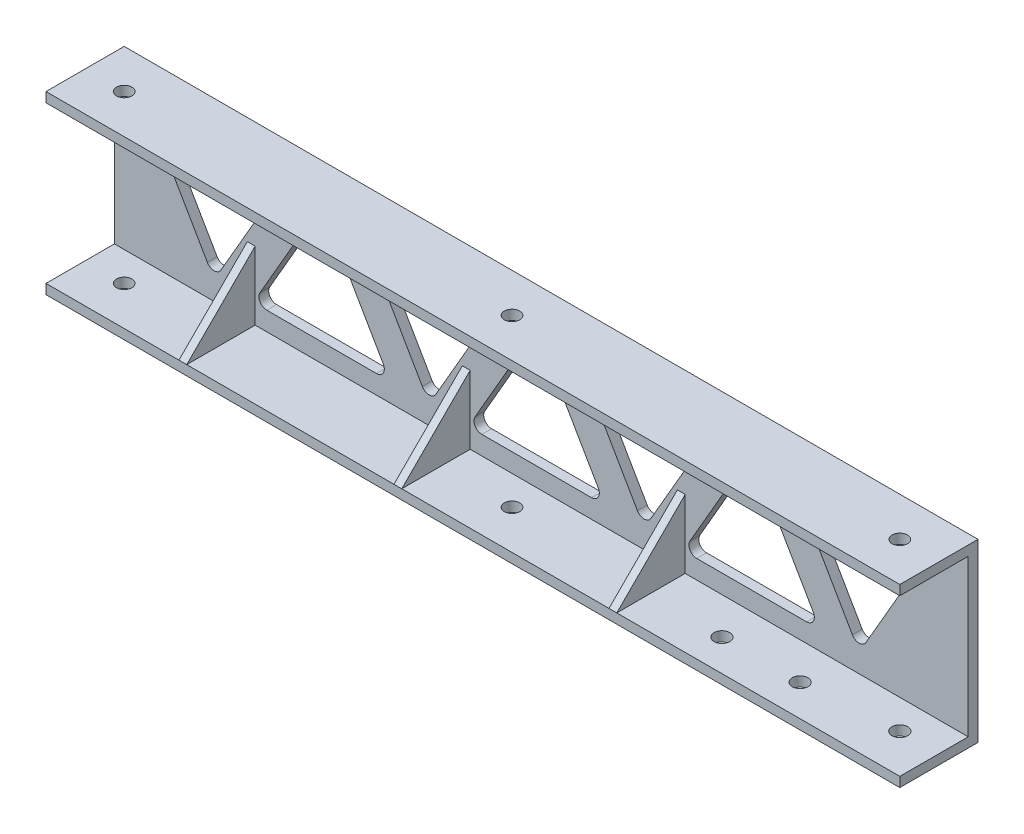
from build123d import *

# Parameters (mm, degrees)
SKETCH1_W                  = 277.368
SKETCH1_H                  = 57.15
BOSS_EXTRUDE1_DEPTH        = 3.175
SKETCH2_W                  = 277.368
SKETCH2_H                  = 25.4
BOSS_EXTRUDE2_DEPTH        = 3.175
SKETCH3_W                  = 277.368
SKETCH3_H                  = 25.4
BOSS_EXTRUDE3_DEPTH        = 3.175
BOSS_EXTRUDE4_DEPTH        = 2.54
BOSS_EXTRUDE5_DEPTH        = 2.54
BOSS_EXTRUDE6_DEPTH        = 2.54
BOSS_EXTRUDE7_DEPTH        = 2.54
BOSS_EXTRUDE8_DEPTH        = 2.54
BOSS_EXTRUDE9_DEPTH        = 2.54
F_10_CLEARANCE_HOLE1_D     = 5.1054
F_10_CLEARANCE_HOLE1_DEPTH = 3.175
F_10_CLEARANCE_HOLE2_D     = 5.1054
F_10_CLEARANCE_HOLE2_DEPTH = 3.175
F_10_CLEARANCE_HOLE3_D     = 4.9784
F_10_CLEARANCE_HOLE3_DEPTH = 3.175
F_10_CLEARANCE_HOLE4_D     = 4.9784
SKETCH22_R                 = 3.770312501
SKETCH22_R_2               = 4.062065624
BOSS_EXTRUDE10_DEPTH       = 3.175


with BuildPart() as part:
    # Sketch1 → Boss-Extrude1 (new body)
    with BuildSketch(Plane.XY):
        with Locations((138.684, 28.575)):
            Rectangle(SKETCH1_W, SKETCH1_H)
        with BuildLine():
            Line((30.185295474, 13.081), (12.359704526, 43.955829198))
            ThreePointArc((12.359704526, 43.955829198), (12.359704526, 46.495829198), (14.559409051, 47.765829198))
            Line((14.559409051, 47.765829198), (50.210590949, 47.765829198))
            ThreePointArc((50.210590949, 47.765829198), (52.410295474, 46.495829198), (52.410295474, 43.955829198))
            Line((52.410295474, 43.955829198), (34.584704526, 13.081))
            ThreePointArc((34.584704526, 13.081), (32.385, 11.811), (30.185295474, 13.081))
        make_face(mode=Mode.SUBTRACT)
        with BuildLine():
            Line((49.484409051, 9.271), (85.135590949, 9.271))
            ThreePointArc((85.135590949, 9.271), (87.335295474, 10.541), (87.335295474, 13.081))
            Line((87.335295474, 13.081), (69.509704526, 43.955829198))
            ThreePointArc((69.509704526, 43.955829198), (67.31, 45.225829198), (65.110295474, 43.955829198))
            Line((65.110295474, 43.955829198), (47.284704526, 13.081))
            ThreePointArc((47.284704526, 13.081), (47.284704526, 10.541), (49.484409051, 9.271))
        make_face(mode=Mode.SUBTRACT)
        with BuildLine():
            Line((100.035295474, 13.081), (82.209704526, 43.955829198))
            ThreePointArc((82.209704526, 43.955829198), (82.209704526, 46.495829198), (84.409409051, 47.765829198))
            Line((84.409409051, 47.765829198), (120.060590949, 47.765829198))
            ThreePointArc((120.060590949, 47.765829198), (122.260295474, 46.495829198), (122.260295474, 43.955829198))
            Line((122.260295474, 43.955829198), (104.434704526, 13.081))
            ThreePointArc((104.434704526, 13.081), (102.235, 11.811), (100.035295474, 13.081))
        make_face(mode=Mode.SUBTRACT)
        with BuildLine():
            Line((119.334409051, 9.271), (154.985590949, 9.271))
            ThreePointArc((154.985590949, 9.271), (157.185295474, 10.541), (157.185295474, 13.081))
            Line((157.185295474, 13.081), (139.359704526, 43.955829198))
            ThreePointArc((139.359704526, 43.955829198), (137.16, 45.225829198), (134.960295474, 43.955829198))
            Line((134.960295474, 43.955829198), (117.134704526, 13.081))
            ThreePointArc((117.134704526, 13.081), (117.134704526, 10.541), (119.334409051, 9.271))
        make_face(mode=Mode.SUBTRACT)
        with BuildLine():
            Line((169.885295474, 13.081), (152.059704526, 43.955829198))
            ThreePointArc((152.059704526, 43.955829198), (152.059704526, 46.495829198), (154.259409051, 47.765829198))
            Line((154.259409051, 47.765829198), (189.910590949, 47.765829198))
            ThreePointArc((189.910590949, 47.765829198), (192.110295474, 46.495829198), (192.110295474, 43.955829198))
            Line((192.110295474, 43.955829198), (174.284704526, 13.081))
            ThreePointArc((174.284704526, 13.081), (172.085, 11.811), (169.885295474, 13.081))
        make_face(mode=Mode.SUBTRACT)
        with BuildLine():
            Line((189.184409051, 9.271), (224.835590949, 9.271))
            ThreePointArc((224.835590949, 9.271), (227.035295474, 10.541), (227.035295474, 13.081))
            Line((227.035295474, 13.081), (209.209704526, 43.955829198))
            ThreePointArc((209.209704526, 43.955829198), (207.01, 45.225829198), (204.810295474, 43.955829198))
            Line((204.810295474, 43.955829198), (186.984704526, 13.081))
            ThreePointArc((186.984704526, 13.081), (186.984704526, 10.541), (189.184409051, 9.271))
        make_face(mode=Mode.SUBTRACT)
        with BuildLine():
            Line((239.735295474, 13.081), (221.909704526, 43.955829198))
            ThreePointArc((221.909704526, 43.955829198), (221.909704526, 46.495829198), (224.109409051, 47.765829198))
            Line((224.109409051, 47.765829198), (259.760590949, 47.765829198))
            ThreePointArc((259.760590949, 47.765829198), (261.960295474, 46.495829198), (261.960295474, 43.955829198))
            Line((261.960295474, 43.955829198), (244.134704526, 13.081))
            ThreePointArc((244.134704526, 13.081), (241.935, 11.811), (239.735295474, 13.081))
        make_face(mode=Mode.SUBTRACT)
    extrude(amount=BOSS_EXTRUDE1_DEPTH)

    # Sketch2 → Boss-Extrude2 (add)
    with BuildSketch(Plane(origin=(0, 57.15, 0), x_dir=(1, 0, 0), z_dir=(0, 1, 0))):
        with Locations((138.684, -12.7)):
            Rectangle(SKETCH2_W, SKETCH2_H)
    extrude(amount=-BOSS_EXTRUDE2_DEPTH)

    # Sketch3 → Boss-Extrude3 (add)
    with BuildSketch(Plane.XZ):
        with Locations((138.684, 12.7)):
            Rectangle(SKETCH3_W, SKETCH3_H)
    extrude(amount=-BOSS_EXTRUDE3_DEPTH)

    # Sketch5 → Boss-Extrude4 (add)
    with BuildSketch(Plane.YZ.offset(43.18)):
        Polygon((3.175, 3.175), (3.175, 25.4), (25.4, 3.175), align=None)
    extrude(amount=BOSS_EXTRUDE4_DEPTH)

    # Sketch6 → Boss-Extrude5 (add)
    with BuildSketch(Plane.YZ.offset(113.03)):
        Polygon((3.175, 25.4), (3.175, 3.175), (25.4, 3.175), align=None)
    extrude(amount=BOSS_EXTRUDE5_DEPTH)

    # Sketch7 → Boss-Extrude6 (add)
    with BuildSketch(Plane.YZ.offset(182.88)):
        Polygon((3.175, 25.4), (3.175, 3.175), (25.4, 3.175), align=None)
    extrude(amount=BOSS_EXTRUDE6_DEPTH)

    # Sketch8 → Boss-Extrude7 (add)
    with BuildSketch(Plane(origin=(76.708, 0, 0), x_dir=(0, -1, 0), z_dir=(-1, 0, 0))):
        Polygon((-53.975, 3.175), (-53.975, 25.4), (-31.75, 3.175), align=None)
    extrude(amount=-BOSS_EXTRUDE7_DEPTH)

    # Sketch9 → Boss-Extrude8 (add)
    with BuildSketch(Plane(origin=(146.558, 0, 0), x_dir=(0, -1, 0), z_dir=(-1, 0, 0))):
        Polygon((-53.975, 25.4), (-53.975, 3.175), (-31.75, 3.175), align=None)
    extrude(amount=-BOSS_EXTRUDE8_DEPTH)

    # Sketch10 → Boss-Extrude9 (add)
    with BuildSketch(Plane(origin=(216.408, 0, 0), x_dir=(0, -1, 0), z_dir=(-1, 0, 0))):
        Polygon((-53.975, 25.4), (-53.975, 3.175), (-31.75, 3.175), align=None)
    extrude(amount=-BOSS_EXTRUDE9_DEPTH)

    # #10 Clearance Hole1
    with Locations(Plane(origin=(0, 3.175, 0), x_dir=(1, 0, 0), z_dir=(0, 1, 0))):
        with Locations((209.299668917, -15.125), (234.699668917, -15.125)):
            Hole(F_10_CLEARANCE_HOLE1_D / 2, depth=F_10_CLEARANCE_HOLE1_DEPTH)

    # #10 Clearance Hole2
    with Locations(Plane(origin=(0, 3.175, 0), x_dir=(1, 0, 0), z_dir=(0, 1, 0))):
        with Locations((264.668, -12.7)):
            Hole(F_10_CLEARANCE_HOLE2_D / 2, depth=F_10_CLEARANCE_HOLE2_DEPTH)

    # #10 Clearance Hole3
    with Locations(Plane(origin=(0, 3.175, 0), x_dir=(1, 0, 0), z_dir=(0, 1, 0))):
        with Locations((138.684, -12.7), (12.7, -12.7)):
            Hole(F_10_CLEARANCE_HOLE3_D / 2, depth=F_10_CLEARANCE_HOLE3_DEPTH)

    # #10 Clearance Hole4 (through all)
    with Locations(Plane(origin=(0, 53.975, 0), x_dir=(-1, 0, 0), z_dir=(0, -1, 0))):
        with Locations((-138.684, -12.7), (-264.668, -12.7), (-12.7, -12.7)):
            Hole(F_10_CLEARANCE_HOLE4_D / 2)

    # Sketch22 → Boss-Extrude10 (add)
    with BuildSketch(Plane.XZ.offset(-53.975)):
        with Locations((234.69966892, 15.125)):
            Circle(SKETCH22_R)
        with Locations((209.29966892, 15.125)):
            Circle(SKETCH22_R_2)
    extrude(amount=-BOSS_EXTRUDE10_DEPTH)


solid = part.part
